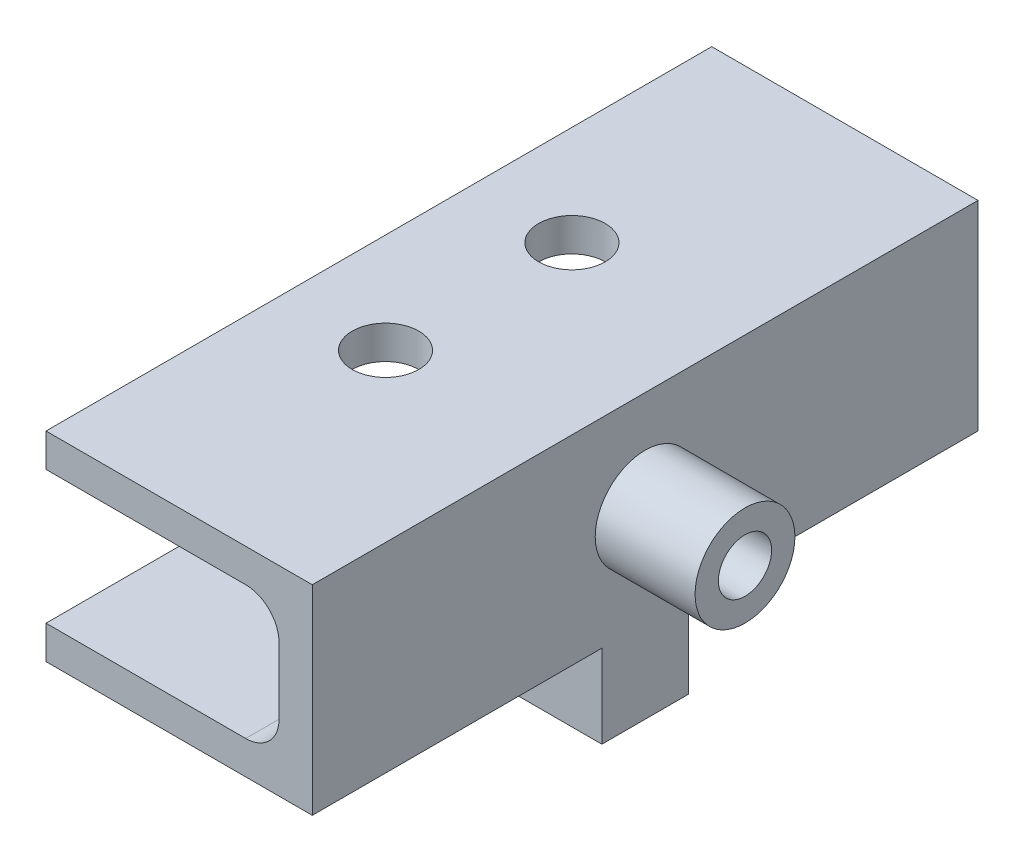
from build123d import *

# Parameters (mm, degrees)
BOSS_EXTRUDE1_DEPTH = 100
FILLET1_R           = 5
SKETCH2_R           = 5
CUT_EXTRUDE1_DEPTH  = 75
SKETCH3_W           = 40
SKETCH3_H           = 13
BOSS_EXTRUDE2_DEPTH = 12.5
SKETCH9_R           = 7.5
BOSS_EXTRUDE6_DEPTH = 15
SKETCH10_R          = 4
CUT_EXTRUDE3_DEPTH  = 15


with BuildPart() as part:
    # Sketch1 → Boss-Extrude1 (new body)
    with BuildSketch(Plane.XY):
        Polygon((0, 0), (35, 0), (35, -20), (0, -20), (0, -25), (40, -25), (40, 5), (0, 5), align=None)
    extrude(amount=BOSS_EXTRUDE1_DEPTH)

    # Fillet1
    fillet1_edges = [part.edges().sort_by_distance(p)[0] for p in [
        (35, -20, 50),
        (35, 0, 50),
    ]]
    fillet(fillet1_edges, radius=FILLET1_R)

    # Sketch2 → Cut-Extrude1 (cut)
    with BuildSketch(Plane(origin=(0, 5, 0), x_dir=(1, 0, 0), z_dir=(0, 1, 0))):
        with Locations(Location((15, -64, 0), (0, 0, 180))):
            Circle(SKETCH2_R)
        with Locations(Location((15, -36, 0), (0, 0, 270))):
            Circle(SKETCH2_R)
    extrude(amount=-CUT_EXTRUDE1_DEPTH, mode=Mode.SUBTRACT)

    # Sketch3 → Boss-Extrude2 (add)
    with BuildSketch(Plane.XZ.offset(25)):
        with Locations((20, 50)):
            Rectangle(SKETCH3_W, SKETCH3_H)
    extrude(amount=BOSS_EXTRUDE2_DEPTH)

    # Sketch9 → Boss-Extrude6 (add)
    with BuildSketch(Plane(origin=(40, 0, 0), x_dir=(0, 0, -1), z_dir=(1, 0, 0))):
        with Locations(Location((-50, -10, 0), (0, 0, 180))):
            Circle(SKETCH9_R)
    extrude(amount=BOSS_EXTRUDE6_DEPTH)

    # Sketch10 → Cut-Extrude3 (cut)
    with BuildSketch(Plane(origin=(55, 0, 0), x_dir=(0, 0, -1), z_dir=(1, 0, 0))):
        with Locations((-50, -10)):
            Circle(SKETCH10_R)
    extrude(amount=-CUT_EXTRUDE3_DEPTH, mode=Mode.SUBTRACT)


solid = part.part
